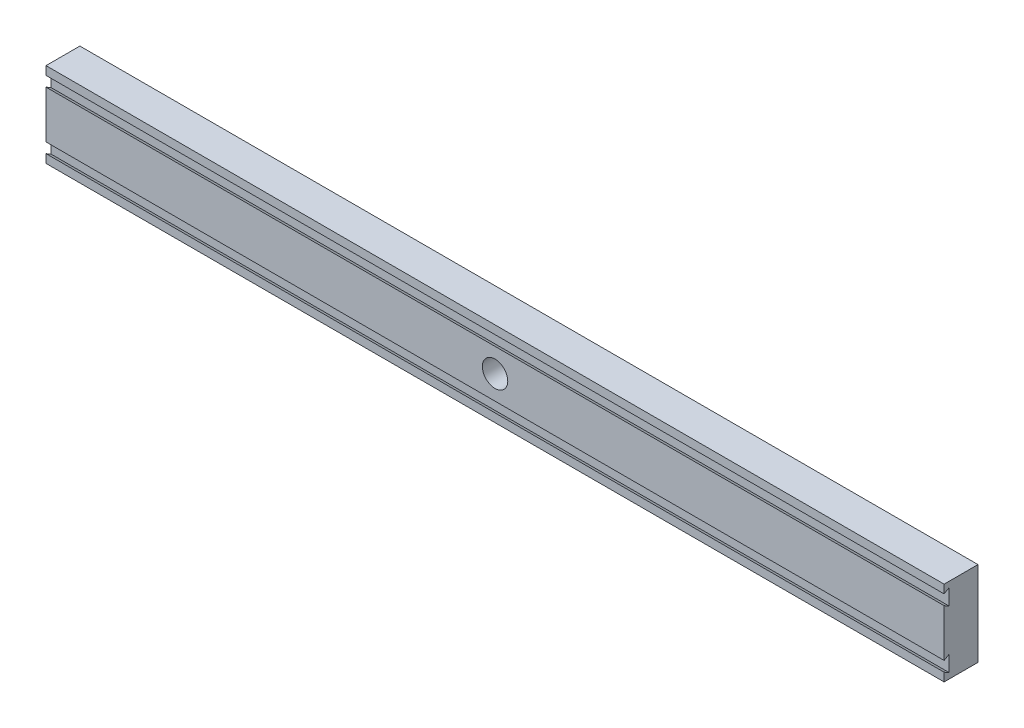
from build123d import *

# Parameters (mm, degrees)
BOSS_EXTRUDE1_DEPTH     = 265
CUT_EXTRUDE2_DEPTH      = 267.364412037
CUT_EXTRUDE2_DEPTH_BACK = 267.364412037
SKETCH3_R               = 7.5
SCALE1_SCALE            = 0.25


with BuildPart() as part:
    # Sketch2 → Boss-Extrude1 (new, symmetric)
    with BuildSketch(Plane(origin=(0, 0, 0), x_dir=(0, 0, -1), z_dir=(1, 0, 0))):
        Polygon((-10, -20), (-10, -25), (10, -25), (10, 25), (-10, 25), (-10, 20), (-7, 21.732050808), (-7, 12.267949192), (-10, 14), (-10, -14), (-7, -12.267949192), (-7, -21.732050808), align=None)
    extrude(amount=BOSS_EXTRUDE1_DEPTH, both=True)

    # Sketch3 → Cut-Extrude2 (cut, two sides: drawn at the far end of the back side and taken through both)
    with BuildSketch(Plane.XY.offset(-CUT_EXTRUDE2_DEPTH_BACK)):
        Circle(SKETCH3_R)
    extrude(amount=CUT_EXTRUDE2_DEPTH + CUT_EXTRUDE2_DEPTH_BACK, mode=Mode.SUBTRACT)


with BuildPart() as part_1:
    # Scale1: scaled about (0, 0, -0.410943417)
    add(part.part.scale(SCALE1_SCALE).moved(Location((0, 0, -0.308207563))))


solid = part_1.part
